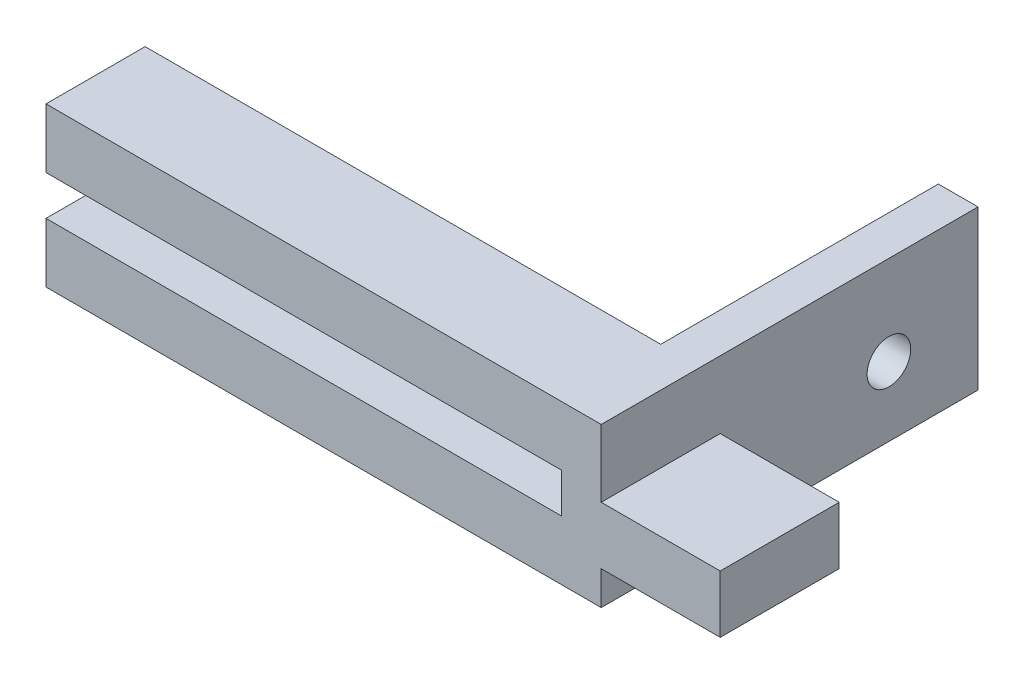
from build123d import *

# Parameters (mm, degrees)
SKETCH1_W           = 95
SKETCH1_H           = 40
BOSS_EXTRUDE1_DEPTH = 10
SKETCH4_W           = 25
SKETCH4_H           = 15
BOSS_EXTRUDE4_DEPTH = 130
SKETCH5_R           = 5.5
CUT_EXTRUDE1_DEPTH  = 27
SKETCH6_W           = 30
SKETCH6_H           = 6
BOSS_EXTRUDE5_DEPTH = 30
SKETCH7_W           = 30
SKETCH7_H           = 30
BOSS_EXTRUDE6_DEPTH = 8.5


with BuildPart() as part:
    # Sketch1 → Boss-Extrude1 (new body)
    with BuildSketch(Plane(origin=(0, 0, 0), x_dir=(0, 0, -1), z_dir=(1, 0, 0))):
        with Locations((11.585365854, 0.129573171)):
            Rectangle(SKETCH1_W, SKETCH1_H)
    extrude(amount=BOSS_EXTRUDE1_DEPTH)

    # Sketch4 → Boss-Extrude4 (add)
    with BuildSketch(Plane.ZY):
        with Locations((23.414634146, 12.629573171)):
            Rectangle(SKETCH4_W, SKETCH4_H)
        with Locations((23.414634146, -12.370426829)):
            Rectangle(SKETCH4_W, SKETCH4_H)
    extrude(amount=BOSS_EXTRUDE4_DEPTH)

    # Sketch5 → Cut-Extrude1 (cut)
    with BuildSketch(Plane.ZY):
        with Locations((-36.625365854, -2.430426829)):
            Circle(SKETCH5_R)
    extrude(amount=-CUT_EXTRUDE1_DEPTH, mode=Mode.SUBTRACT)

    # Sketch6 → Boss-Extrude5 (add)
    with BuildSketch(Plane(origin=(10, 0, 0), x_dir=(0, 0, -1), z_dir=(1, 0, 0))):
        with Locations((-20.914634146, 0.129573171)):
            Rectangle(SKETCH6_W, SKETCH6_H)
    extrude(amount=BOSS_EXTRUDE5_DEPTH)

    # Sketch7 → Boss-Extrude6 (add)
    with BuildSketch(Plane.XZ.offset(2.870426829)):
        with Locations((25, 20.914634146)):
            Rectangle(SKETCH7_W, SKETCH7_H)
    extrude(amount=BOSS_EXTRUDE6_DEPTH)


solid = part.part
